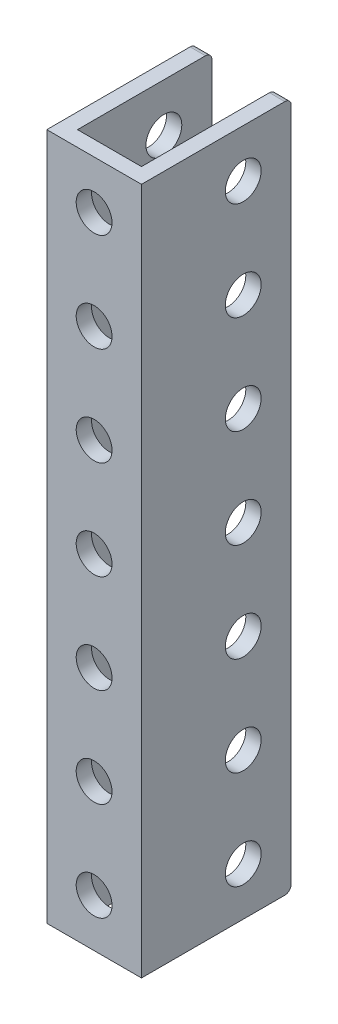
from build123d import *

# Parameters (mm, degrees)
SKETCH1_W                 = 68.199
SKETCH1_H                 = 14.859
BOSS_EXTRUDE1_DEPTH       = 9.398
SKETCH2_W                 = 6.35
SKETCH2_H                 = 13.335
CUT_EXTRUDE1_DEPTH        = 70.649166736
F_5_CLEARANCE_HOLE1_D     = 3.556
F_5_CLEARANCE_HOLE1_DEPTH = 1.524
F_5_CLEARANCE_HOLE2_D     = 3.556
F_5_CLEARANCE_HOLE2_DEPTH = 14.859
F_5_CLEARANCE_HOLE3_D     = 3.556
FILLET1_R                 = 0.635


with BuildPart() as part:
    # Sketch1 → Boss-Extrude1 (new body)
    with BuildSketch(Plane(origin=(-4.699, 0, 0), x_dir=(0, -1, 0), z_dir=(-1, 0, 0))):
        with Locations((-34.0995, -5.9055)):
            Rectangle(SKETCH1_W, SKETCH1_H)
    extrude(amount=-BOSS_EXTRUDE1_DEPTH)

    # Sketch2 → Cut-Extrude1 (cut, through all)
    with BuildSketch(Plane.XZ):
        with Locations((0, -6.6675)):
            Rectangle(SKETCH2_W, SKETCH2_H)
    extrude(amount=-CUT_EXTRUDE1_DEPTH, mode=Mode.SUBTRACT)

    # #5 Clearance Hole1
    with Locations(Plane(origin=(4.699, 0, 0), x_dir=(0, 0, -1), z_dir=(1, 0, 0))):
        with Locations((8.5725, 53.6575), (8.5725, 63.4365), (8.5725, 43.8785), (8.5725, 34.0995), (8.5725, 24.3205), (8.5725, 14.5415), (8.5725, 4.7625)):
            Hole(F_5_CLEARANCE_HOLE1_D / 2, depth=F_5_CLEARANCE_HOLE1_DEPTH)

    # #5 Clearance Hole2
    with Locations(Plane.XY.offset(1.524)):
        with Locations((0, 53.6575), (0, 63.4365), (0, 43.8785), (0, 34.0995), (0, 24.3205), (0, 14.5415), (0, 4.7625)):
            Hole(F_5_CLEARANCE_HOLE2_D / 2, depth=F_5_CLEARANCE_HOLE2_DEPTH)

    # #5 Clearance Hole3 (through all)
    with Locations(Plane(origin=(-3.175, 0, 0), x_dir=(0, 0, -1), z_dir=(1, 0, 0))):
        with Locations((8.5725, 53.6575), (8.5725, 63.4365), (8.5725, 43.8785), (8.5725, 34.0995), (8.5725, 24.3205), (8.5725, 14.5415), (8.5725, 4.7625)):
            Hole(F_5_CLEARANCE_HOLE3_D / 2)

    # Fillet1
    fillet1_edges = [part.edges().sort_by_distance(p)[0] for p in [
        (-3.937, 68.199, -13.335),
        (-3.937, 0, -13.335),
        (3.937, 0, -13.335),
        (3.937, 68.199, -13.335),
    ]]
    fillet(fillet1_edges, radius=FILLET1_R)


solid = part.part
